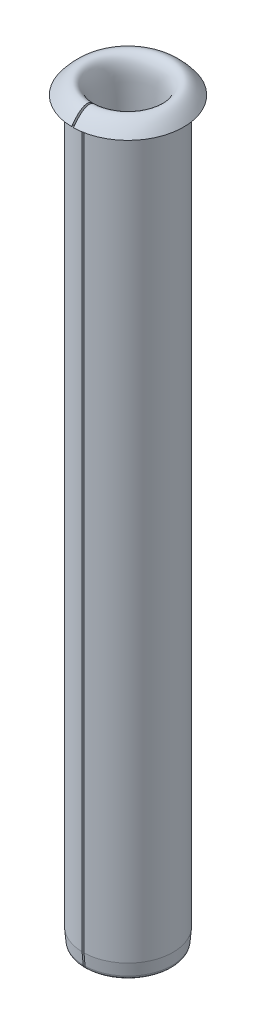
from build123d import *

# Parameters (mm, degrees)
CUT_EXTRUDE1_DEPTH      = 27.518252873
CUT_EXTRUDE1_DEPTH_BACK = 27.518252873
SKETCH4_W               = 0.127
SKETCH4_H               = 4.445496727
CHAMFER1_SIZE           = 1.016
CHAMFER1_SIZE2          = 0.088888482
FILLET1_R               = 0.254


with BuildPart() as part:
    # Sketch3 → Revolve1 (revolve)
    with BuildSketch(Plane(origin=(0, 0, 0), x_dir=(0, 0, -1), z_dir=(1, 0, 0)), mode=Mode.PRIVATE) as revolve1_sk:
        with BuildLine():
            Line((1.9431, -9.0805), (1.9431, 6.045643841))
            add(Edge.make_bspline(
                [(1.9431, 6.045643841), (1.9431, 10.091751432), (1.891096799, 23.164078911), (1.955698004, 25.891289644), (2.657297247, 26.530501845), (3.65125, 25.2095)],
                knots=[0, 0, 0, 0, 0.515431556, 0.615431556, 1, 1, 1, 1], degree=3))
            Line((3.65125, 25.2095), (3.20458454, 25.2095))
            ThreePointArc((3.20458454, 25.2095), (3.024979417, 25.135105122), (2.95058454, 24.9555))
            Line((2.95058454, 24.9555), (2.95058454, 24.211681499))
            Line((2.95058454, 24.211681499), (2.95058454, -9.0805))
            Line((2.95058454, -9.0805), (2.95058454, -23.0505))
            Line((2.95058454, -23.0505), (1.9431, -23.0505))
            Line((1.9431, -23.0505), (1.9431, -9.0805))
        make_face()
    revolve(revolve1_sk.sketch.rotate(Axis((0, 25.2095, 0), (0, -1, 0)), 180), axis=Axis((0, 25.2095, 0), (0, -1, 0)))

    # Sketch4 → Cut-Extrude1 (cut, two sides: drawn at the far end of the back side and taken through both)
    with BuildSketch(Plane(origin=(0, 0, 0), x_dir=(1, 0, 0), z_dir=(0, 1, 0)).offset(-CUT_EXTRUDE1_DEPTH_BACK)):
        with Locations((0, -2.222748364)):
            Rectangle(SKETCH4_W, SKETCH4_H)
    extrude(amount=CUT_EXTRUDE1_DEPTH + CUT_EXTRUDE1_DEPTH_BACK, mode=Mode.SUBTRACT)

    # Chamfer1
    chamfer1_edges = [part.edges().sort_by_distance(p)[0] for p in [
        (0, -23.0505, -2.95058454),
    ]]
    chamfer1_side = [part.faces().sort_by_distance(p)[0] for p in [
        (0, 0.9525, -2.95058454),
    ]]
    chamfer(chamfer1_edges, length=CHAMFER1_SIZE, length2=CHAMFER1_SIZE2, reference=chamfer1_side[0])

    # Fillet1
    fillet1_edges = [part.edges().sort_by_distance(p)[0] for p in [
        (0, -23.0505, -2.861696057),
    ]]
    fillet(fillet1_edges, radius=FILLET1_R)


solid = part.part
